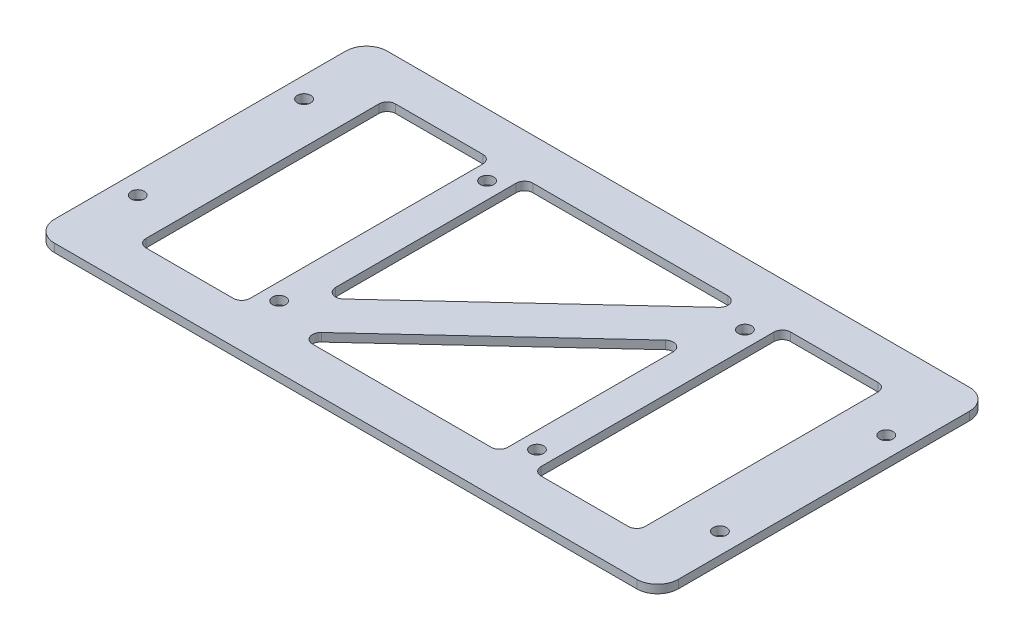
from build123d import *

# Parameters (mm, degrees)
SKETCH_1_W              = 150
SKETCH_1_H              = 80
EXTRUDE_1_DEPTH         = 2
HOLE_WIZARD_3_2_3_2_1_D = 3.2
FILLET_1_R              = 5
SKETCH_4_W              = 25
SKETCH_4_H              = 60
CUT_EXTRUDE_1_DEPTH     = 86.023526156
FILLET_2_R              = 2


with BuildPart() as part:
    # 草图1 → 凸台-拉伸1 (new body)
    with BuildSketch(Plane(origin=(0, 0, 0), x_dir=(1, 0, 0), z_dir=(0, 1, 0))):
        Rectangle(SKETCH_1_W, SKETCH_1_H)
    extrude(amount=EXTRUDE_1_DEPTH)

    # Ø3.2 (3.2) 直径孔1 (through all)
    with Locations(Plane(origin=(-31, 2, -25), x_dir=(0, 0, 1), z_dir=(0, 1, 0))):
        with Locations((0, 0), (50, 0), (50, 62), (0, 62), (5, -39), (45, -39), (45, 101), (5, 101)):
            Hole(HOLE_WIZARD_3_2_3_2_1_D / 2)

    # 圆角1
    fillet_1_edges = [part.edges().sort_by_distance(p)[0] for p in [
        (75, 1, 40),
        (-75, 1, 40),
        (-75, 1, -40),
        (75, 1, -40),
    ]]
    fillet(fillet_1_edges, radius=FILLET_1_R)

    # 草图4 → 切除-拉伸1 (cut, through all)
    with BuildSketch(Plane(origin=(0, 2, 0), x_dir=(1, 0, 0), z_dir=(0, 1, 0))):
        with Locations((-47.5, 0)):
            Rectangle(SKETCH_4_W, SKETCH_4_H)
        Polygon((-27, 30), (-27, -20), (27, 30), align=None)
        Polygon((-23.081304406, -30), (27, -30), (27, 16.371578153), align=None)
        with Locations((47.5, 0)):
            Rectangle(SKETCH_4_W, SKETCH_4_H)
    extrude(amount=-CUT_EXTRUDE_1_DEPTH, mode=Mode.SUBTRACT)

    # 圆角2
    fillet_2_edges = [part.edges().sort_by_distance(p)[0] for p in [
        (-60, 1, 30),
        (-60, 1, -30),
        (-35, 1, -30),
        (-35, 1, 30),
        (-23.081304406, 1, 30),
        (27, 1, -16.371578153),
        (27, 1, 30),
        (-27, 1, -30),
        (27, 1, -30),
        (-27, 1, 20),
        (60, 1, -30),
        (60, 1, 30),
        (35, 1, 30),
        (35, 1, -30),
    ]]
    fillet(fillet_2_edges, radius=FILLET_2_R)


solid = part.part
